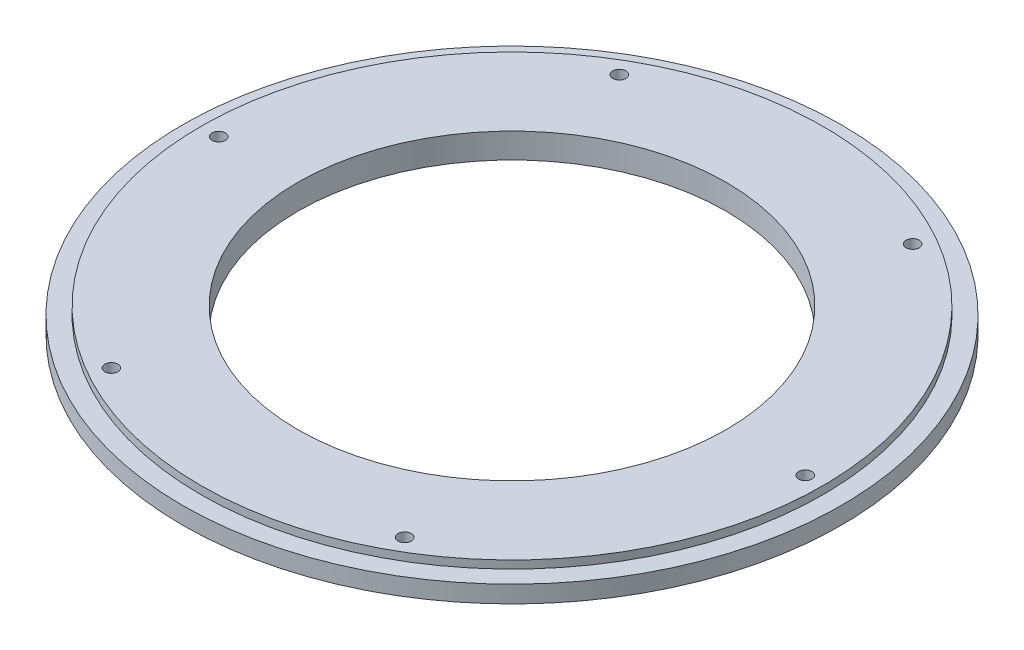
from build123d import *

# Parameters (mm, degrees)
SKETCH1_R           = 250
SKETCH1_R_2         = 162.5
BOSS_EXTRUDE1_DEPTH = 19
CUT_EXTRUDE1_START  = -6
SKETCH2_R           = 250
SKETCH2_R_2         = 236
CUT_EXTRUDE1_DEPTH  = 6
SKETCH3_R           = 5
CUT_EXTRUDE2_DEPTH  = 355.063553617


with BuildPart() as part:
    # Sketch1 → Boss-Extrude1 (new body)
    with BuildSketch(Plane(origin=(0, 0, 0), x_dir=(1, 0, 0), z_dir=(0, 1, 0))):
        with Locations(Location((0, 0, 0), (0, 0, 270))):
            Circle(SKETCH1_R)
        with Locations(Location((0, 0, 0), (0, 0, 270))):
            Circle(SKETCH1_R_2, mode=Mode.SUBTRACT)
    extrude(amount=BOSS_EXTRUDE1_DEPTH)

    # Sketch2 → Cut-Extrude1 (cut)
    with BuildSketch(Plane(origin=(0, 19, 0), x_dir=(1, 0, 0), z_dir=(0, 1, 0)).offset(CUT_EXTRUDE1_START)):
        with Locations(Location((0, 0, 0), (0, 0, 270))):
            Circle(SKETCH2_R)
        with Locations(Location((0, 0, 0), (0, 0, 270))):
            Circle(SKETCH2_R_2, mode=Mode.SUBTRACT)
    extrude(amount=CUT_EXTRUDE1_DEPTH, mode=Mode.SUBTRACT)

    # Sketch3 → Cut-Extrude2 (cut, through all)
    with BuildSketch(Plane(origin=(0, 19, 0), x_dir=(1, 0, 0), z_dir=(0, 1, 0))):
        with Locations(Location((111.25, 192.690652342, 0), (0, 0, 270))):
            Circle(SKETCH3_R)
        with Locations(Location((111.25, -192.690652342, 0), (0, 0, 90))):
            Circle(SKETCH3_R)
        with Locations(Location((-111.25, -192.690652342, 0), (0, 0, 270))):
            Circle(SKETCH3_R)
        with Locations(Location((222.5, 0, 0), (0, 0, 270))):
            Circle(SKETCH3_R)
        with Locations(Location((-111.25, 192.690652342, 0), (0, 0, 90))):
            Circle(SKETCH3_R)
        with Locations(Location((-222.5, 0, 0), (0, 0, 90))):
            Circle(SKETCH3_R)
    extrude(amount=-CUT_EXTRUDE2_DEPTH, mode=Mode.SUBTRACT)


solid = part.part
